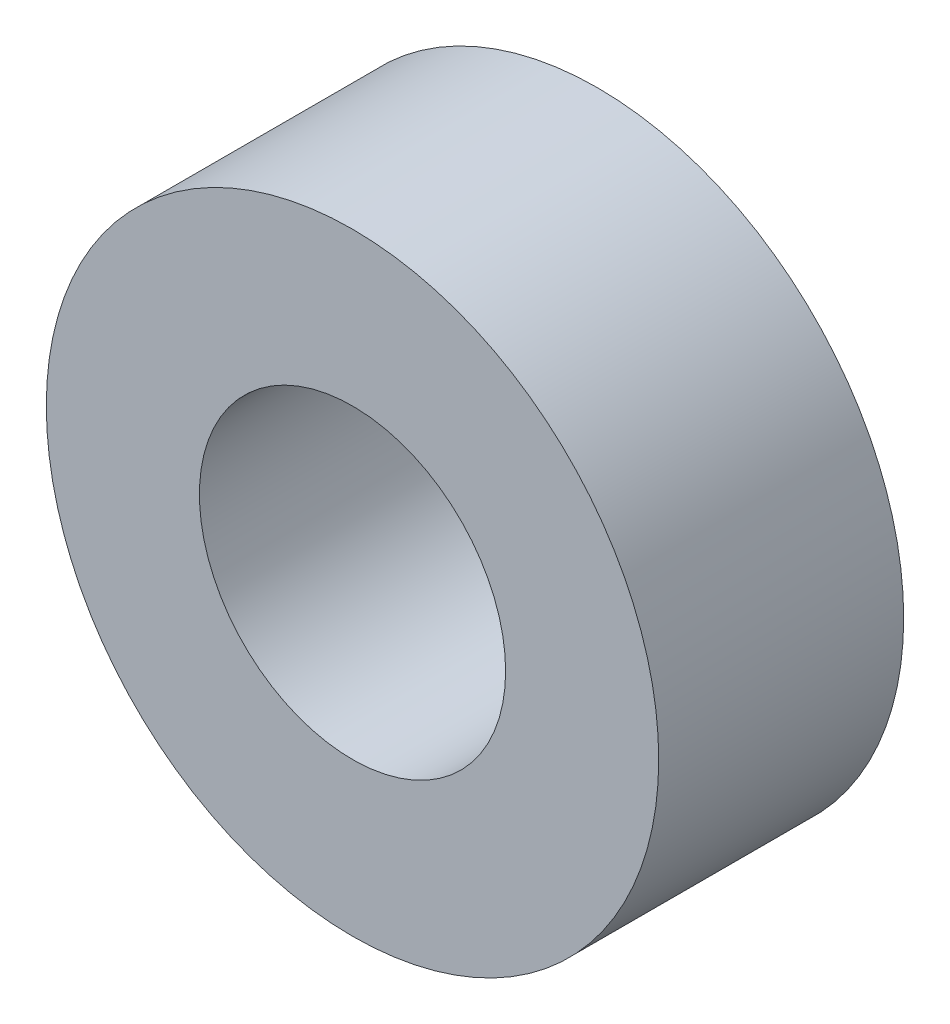
from build123d import *

# Parameters (mm, degrees)
SKETCH1_R           = 1.25
SKETCH1_R_2         = 0.625
BOSS_EXTRUDE1_DEPTH = 1


with BuildPart() as part:
    # Sketch1 → Boss-Extrude1 (new body)
    with BuildSketch(Plane.XY):
        Circle(SKETCH1_R)
        Circle(SKETCH1_R_2, mode=Mode.SUBTRACT)
    extrude(amount=BOSS_EXTRUDE1_DEPTH)


solid = part.part
